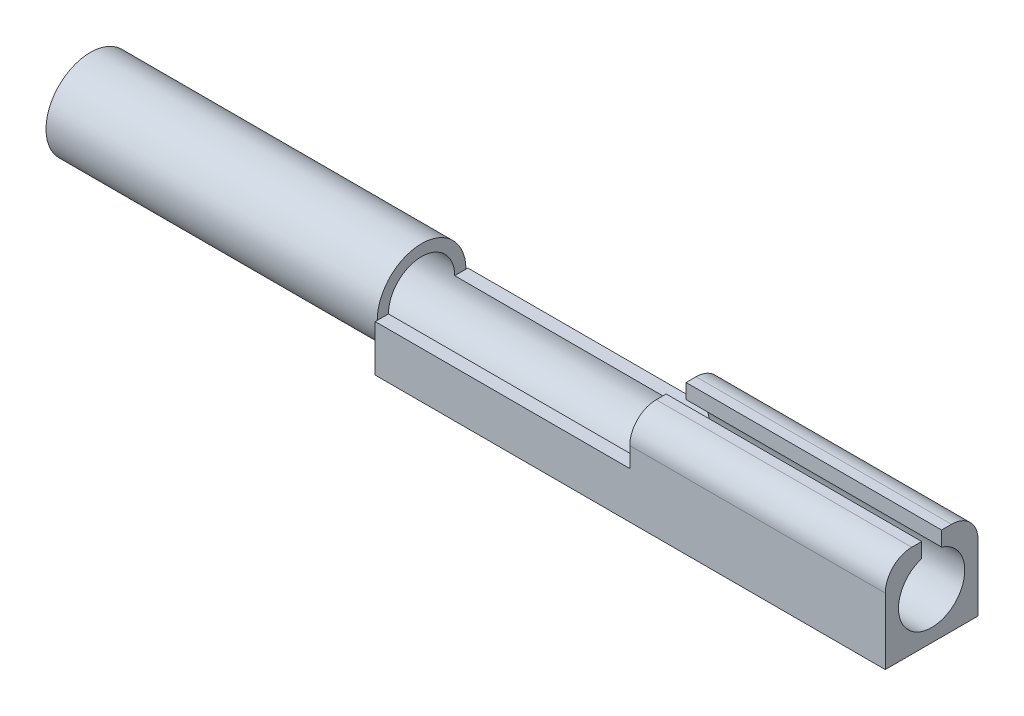
from build123d import *

# Parameters (mm, degrees)
SKETCH_1_W          = 12.7
SKETCH_1_H          = 1.4
EXTRUDE_1_DEPTH     = 1.4
SKETCH_2_R          = 0.5
CUT_EXTRUDE_1_DEPTH = 20
SKETCH_3_W          = 1.58287555
SKETCH_3_H          = 1.56846706
SKETCH_3_R          = 0.669855652
CUT_EXTRUDE_2_DEPTH = 5
CUT_EXTRUDE_3_DEPTH = 0.7
FILLET_1_R          = 0.4


with BuildPart() as part:
    # Эскиз1 → Вытянуть1 (new body)
    with BuildSketch(Plane.XY):
        with Locations((6.35, 0.7)):
            Rectangle(SKETCH_1_W, SKETCH_1_H)
    extrude(amount=EXTRUDE_1_DEPTH)

    # Эскиз2 → Вырез-Вытянуть1 (cut)
    with BuildSketch(Plane.ZY):
        with Locations((0.7, 0.7)):
            Circle(SKETCH_2_R)
    extrude(amount=-CUT_EXTRUDE_1_DEPTH, mode=Mode.SUBTRACT)

    # Эскиз3 → Вырез-Вытянуть2 (cut)
    with BuildSketch(Plane.ZY):
        with Locations((0.694854111, 0.698970822)):
            Rectangle(SKETCH_3_W, SKETCH_3_H)
        with Locations((0.7, 0.7)):
            Circle(SKETCH_3_R, mode=Mode.SUBTRACT)
    extrude(amount=-CUT_EXTRUDE_2_DEPTH, mode=Mode.SUBTRACT)

    # Эскиз4 → Вырез-Вытянуть3 (cut)
    with BuildSketch(Plane(origin=(0, 1.4, 0), x_dir=(-1, 0, 0), z_dir=(0, 1, 0))):
        Polygon((-5, -0.383611345), (-8.842742291, -0.383611345), (-8.842742291, 0.55), (-12.931959982, 0.55), (-12.931959982, 0.85), (-8.842742291, 0.85), (-8.842742291, 1.950417018), (-5, 1.950417018), align=None)
    extrude(amount=-CUT_EXTRUDE_3_DEPTH, mode=Mode.SUBTRACT)

    # Скругление1
    fillet_1_edges = [part.edges().sort_by_distance(p)[0] for p in [
        (10.771371146, 1.4, 0),
        (10.771371146, 1.4, 1.4),
    ]]
    fillet(fillet_1_edges, radius=FILLET_1_R)


solid = part.part
